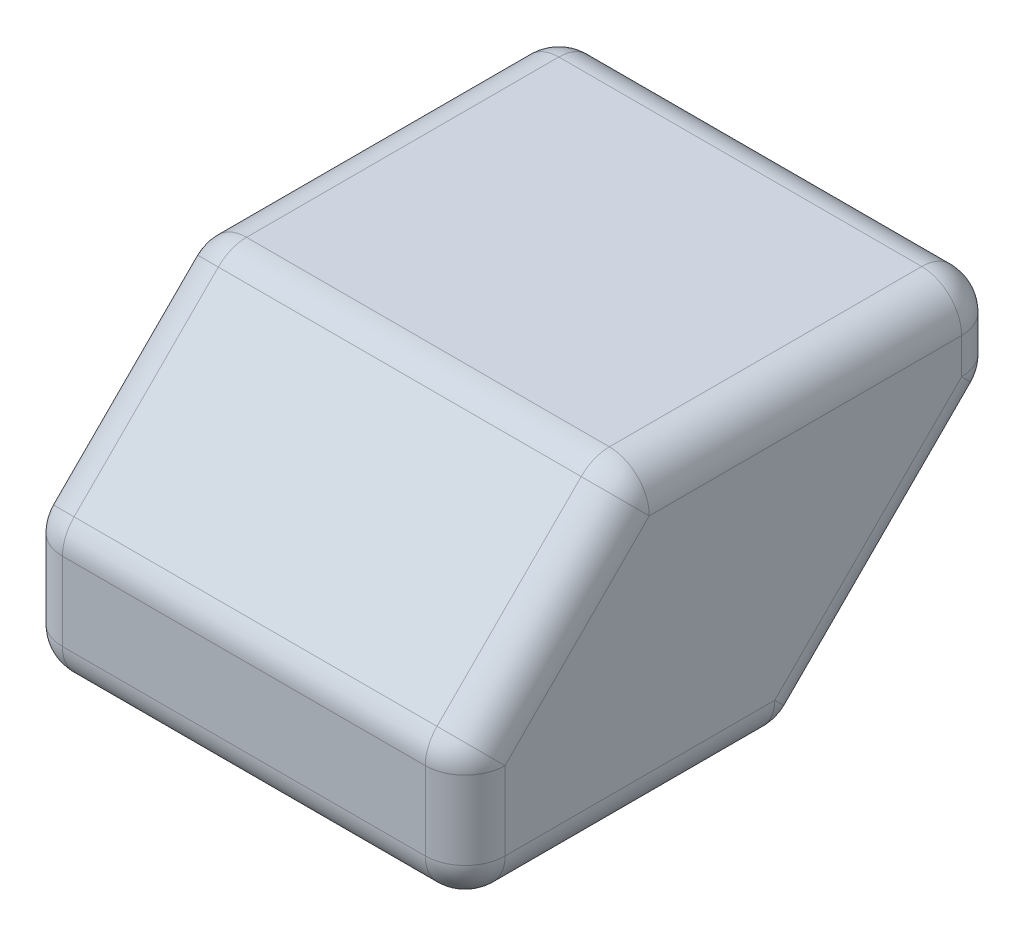
from build123d import *

# Parameters (mm, degrees)
SKETCH1_W           = 26.416
SKETCH1_H           = 32.004
BOSS_EXTRUDE1_DEPTH = 18.034
CHAMFER1_SIZE       = 12.54
CHAMFER2_SIZE       = 10
FILLET1_R           = 2.38


with BuildPart() as part:
    # Sketch1 → Boss-Extrude1 (new body)
    with BuildSketch(Plane(origin=(0, 0, 0), x_dir=(1, 0, 0), z_dir=(0, 1, 0))):
        with Locations((13.208, 16.002)):
            Rectangle(SKETCH1_W, SKETCH1_H)
    extrude(amount=BOSS_EXTRUDE1_DEPTH)

    # Chamfer1
    chamfer1_edges = [part.edges().sort_by_distance(p)[0] for p in [
        (13.208, 0, -32.004),
    ]]
    chamfer(chamfer1_edges, length=CHAMFER1_SIZE)

    # Chamfer2
    chamfer2_edges = [part.edges().sort_by_distance(p)[0] for p in [
        (13.208, 18.034, 0),
    ]]
    chamfer(chamfer2_edges, length=CHAMFER2_SIZE)

    # Fillet1
    fillet1_edges = [part.edges().sort_by_distance(p)[0] for p in [
        (13.208, 12.54, -32.004),
        (0, 0, -9.732),
        (0, 6.27, -25.734),
        (13.208, 0, -19.464),
        (26.416, 6.27, -25.734),
        (13.208, 18.034, -32.004),
        (26.416, 18.034, -21.002),
        (13.208, 18.034, -10),
        (26.416, 4.017, 0),
        (26.416, 13.034, -5),
        (0, 4.017, 0),
        (13.208, 8.034, 0),
        (0, 13.034, -5),
        (0, 18.034, -21.002),
        (26.416, 0, -9.732),
        (13.208, 0, 0),
        (0, 15.287, -32.004),
        (26.416, 15.287, -32.004),
    ]]
    fillet(fillet1_edges, radius=FILLET1_R)


solid = part.part
